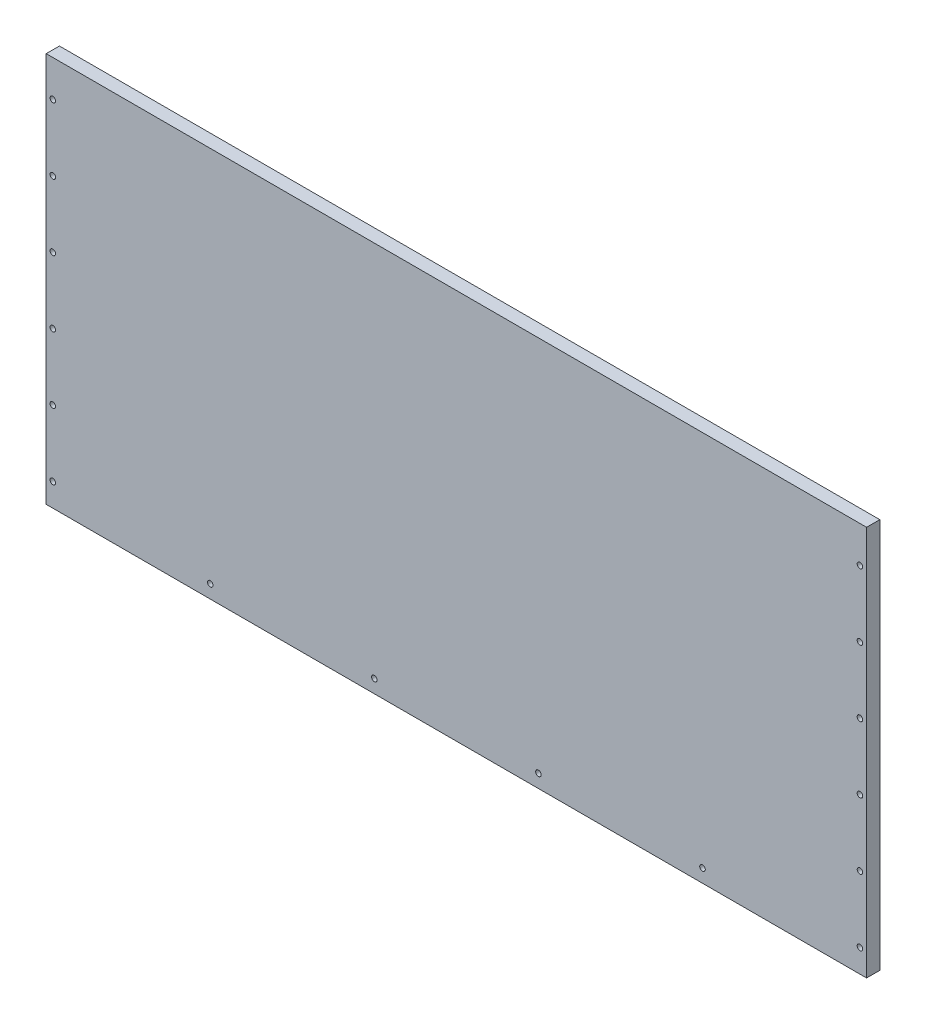
from build123d import *

# Parameters (mm, degrees)
SKETCH_1_W                  = 620
SKETCH_1_H                  = 295
EXTRUDE_1_DEPTH             = 10
HOLE_WIZARD_M5_1_AT_2_COUNT = 2
HOLE_WIZARD_M5_1_AT_2_PITCH = 610
PATTERN_LINEAR_1_COUNT      = 6
PATTERN_LINEAR_1_PITCH      = 50
HOLE_WIZARD_M5_2_D          = 4.2


with BuildPart() as part:
    # 草图1 → 凸台-拉伸1 (new body)
    with BuildSketch(Plane.XY):
        Rectangle(SKETCH_1_W, SKETCH_1_H)
    extrude(amount=EXTRUDE_1_DEPTH)

    # 草图4 → M5 螺纹孔1 (revolve, cut)
    with BuildSketch(Plane(origin=(-305, 120, 10), x_dir=(0, -1, 0), z_dir=(1, 0, 0))):
        Polygon((0, 0), (0, 13.4618073), (2.1, 12.2), (2.1, 0), align=None)
    hole_wizard_m5_1 = revolve(axis=Axis((-305, 120, 16.35), (0, 0, -1)), mode=Mode.SUBTRACT)

    # M5 螺纹孔1 at 2: M5 螺纹孔1 ×2
    with Locations(*[(i * HOLE_WIZARD_M5_1_AT_2_PITCH, 0, 0) for i in range(1, HOLE_WIZARD_M5_1_AT_2_COUNT)]):
        add(hole_wizard_m5_1, mode=Mode.SUBTRACT)

    # 阵列(线性)1: M5 螺纹孔1 ×6
    with Locations(*[(0, -i * PATTERN_LINEAR_1_PITCH, 0) for i in range(1, PATTERN_LINEAR_1_COUNT)]):
        add(hole_wizard_m5_1, mode=Mode.SUBTRACT)

    # 阵列(线性)1 copy 1 sketch → 阵列(线性)1 copy 1 (revolve, cut)
    with BuildSketch(Plane(origin=(305, 70, 10), x_dir=(0, -1, 0), z_dir=(1, 0, 0))):
        Polygon((0, 0), (0, 13.4618073), (2.1, 12.2), (2.1, 0), align=None)
    revolve(axis=Axis((305, 70, 16.35), (0, 0, -1)), mode=Mode.SUBTRACT)

    # 阵列(线性)1 copy 2 sketch → 阵列(线性)1 copy 2 (revolve, cut)
    with BuildSketch(Plane(origin=(305, 20, 10), x_dir=(0, -1, 0), z_dir=(1, 0, 0))):
        Polygon((0, 0), (0, 13.4618073), (2.1, 12.2), (2.1, 0), align=None)
    revolve(axis=Axis((305, 20, 16.35), (0, 0, -1)), mode=Mode.SUBTRACT)

    # 阵列(线性)1 copy 3 sketch → 阵列(线性)1 copy 3 (revolve, cut)
    with BuildSketch(Plane(origin=(305, -30, 10), x_dir=(0, -1, 0), z_dir=(1, 0, 0))):
        Polygon((0, 0), (0, 13.4618073), (2.1, 12.2), (2.1, 0), align=None)
    revolve(axis=Axis((305, -30, 16.35), (0, 0, -1)), mode=Mode.SUBTRACT)

    # 阵列(线性)1 copy 4 sketch → 阵列(线性)1 copy 4 (revolve, cut)
    with BuildSketch(Plane(origin=(305, -80, 10), x_dir=(0, -1, 0), z_dir=(1, 0, 0))):
        Polygon((0, 0), (0, 13.4618073), (2.1, 12.2), (2.1, 0), align=None)
    revolve(axis=Axis((305, -80, 16.35), (0, 0, -1)), mode=Mode.SUBTRACT)

    # 阵列(线性)1 copy 5 sketch → 阵列(线性)1 copy 5 (revolve, cut)
    with BuildSketch(Plane(origin=(305, -130, 10), x_dir=(0, -1, 0), z_dir=(1, 0, 0))):
        Polygon((0, 0), (0, 13.4618073), (2.1, 12.2), (2.1, 0), align=None)
    revolve(axis=Axis((305, -130, 16.35), (0, 0, -1)), mode=Mode.SUBTRACT)

    # M5 螺纹孔2 (through all)
    with Locations(Plane.XY.offset(10)):
        with Locations((-186, -137.5), (-62, -137.5), (62, -137.5), (186, -137.5)):
            Hole(HOLE_WIZARD_M5_2_D / 2)


solid = part.part
